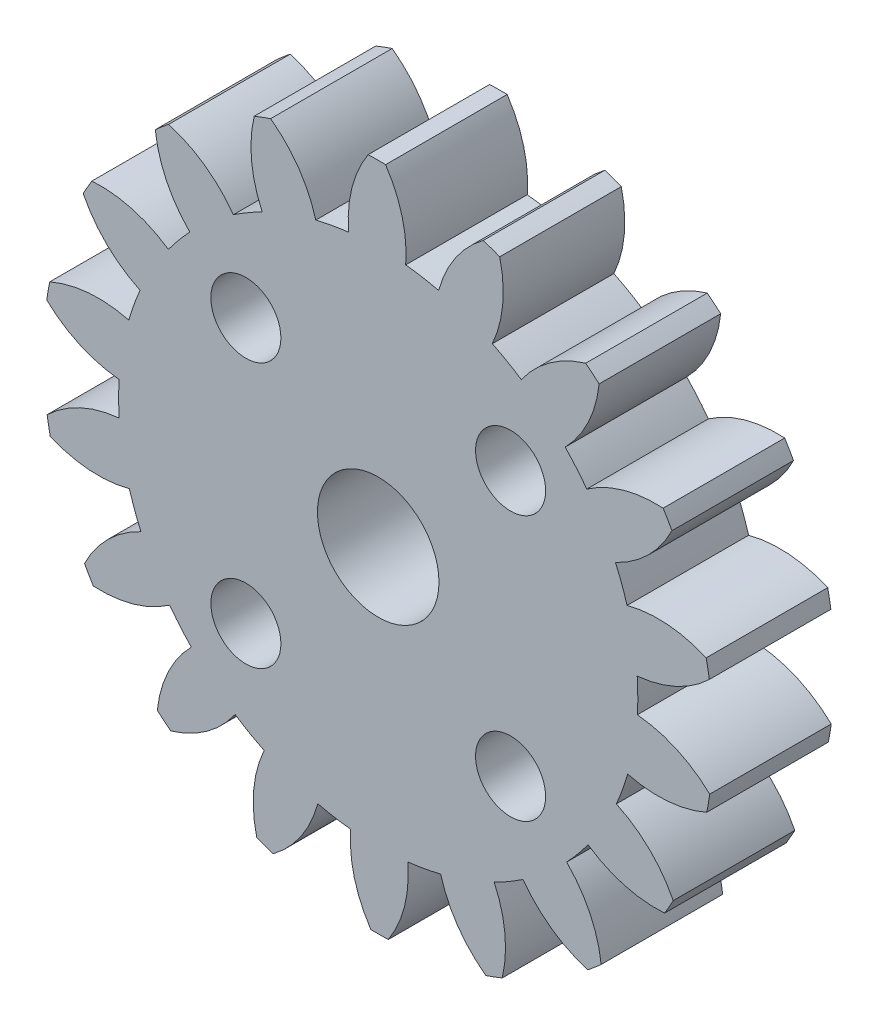
from build123d import *

# Parameters (mm, degrees)
BOSS_EXTRU_1_DEPTH = 3.175
ESQUISSE2_R        = 3.175
ESQUISSE2_R_2      = 1.83
CUT_EXTRUDE1_DEPTH = 26.426049992


with BuildPart() as part:
    # Esquisse1 → Boss.-Extru.1 (new, symmetric)
    with BuildSketch(Plane.XY):
        with BuildLine():
            ThreePointArc((12.39632517, 5.499582215), (14.117106651, 6.707055833), (15.344833887, 8.413445964))
            ThreePointArc((15.344833887, 8.413445964), (15.119886604, 8.811301214), (14.884626197, 9.203146363))
            ThreePointArc((14.884626197, 9.203146363), (12.79475517, 8.97616501), (10.895903967, 8.074252844))
            ThreePointArc((10.895903967, 8.074252844), (10.353325809, 8.759162457), (9.767767389, 9.407709736))
            ThreePointArc((9.767767389, 9.407709736), (10.97179275, 11.130905713), (11.541859176, 13.154295373))
            ThreePointArc((11.541859176, 13.154295373), (11.194403365, 13.451220514), (10.839311962, 13.73897071))
            ThreePointArc((10.839311962, 13.73897071), (8.953107774, 12.81090002), (7.47724344, 11.313934452))
            ThreePointArc((7.47724344, 11.313934452), (6.733133864, 11.771966302), (5.961072705, 12.18112862))
            ThreePointArc((5.961072705, 12.18112862), (6.503118716, 14.21220409), (6.346765909, 16.308542623))
            ThreePointArc((6.346765909, 16.308542623), (5.918709868, 16.4687241), (5.486616734, 16.617672425))
            ThreePointArc((5.486616734, 16.617672425), (4.031583448, 15.100451419), (3.156717001, 13.18898859))
            ThreePointArc((3.156717001, 13.18898859), (2.300826605, 13.364897275), (1.435384677, 13.485323618))
            ThreePointArc((1.435384677, 13.485323618), (1.25007259, 15.579300904), (0.386159005, 17.495738945))
            ThreePointArc((0.386159005, 17.495738945), (-0.07086739, 17.499856508), (-0.527845446, 17.492037594))
            ThreePointArc((-0.527845446, 17.492037594), (-1.376209343, 15.568665517), (-1.544556096, 13.473256055))
            ThreePointArc((-1.544556096, 13.473256055), (-2.408994299, 13.345824393), (-3.263431928, 13.162989565))
            ThreePointArc((-3.263431928, 13.162989565), (-4.15375074, 15.067304103), (-5.621024374, 16.57269094))
            ThreePointArc((-5.621024374, 16.57269094), (-6.051896994, 16.420247951), (-6.478641676, 16.256604874))
            ThreePointArc((-6.478641676, 16.256604874), (-6.618010975, 14.159068786), (-6.059532932, 12.132449995))
            ThreePointArc((-6.059532932, 12.132449995), (-6.828254938, 11.717048125), (-7.568630479, 11.253004706))
            ThreePointArc((-7.568630479, 11.253004706), (-9.056570428, 12.737968057), (-10.950229256, 13.650731821))
            ThreePointArc((-10.950229256, 13.650731821), (-11.302978505, 13.360115154), (-11.648018105, 13.060385685))
            ThreePointArc((-11.648018105, 13.060385685), (-11.061582813, 11.041679393), (-9.843640668, 9.328291411))
            ThreePointArc((-9.843640668, 9.328291411), (-10.423927257, 8.675022928), (-10.960940493, 7.985741403))
            ThreePointArc((-10.960940493, 7.985741403), (-12.867034061, 8.872245071), (-14.958674882, 9.082292981))
            ThreePointArc((-14.958674882, 9.082292981), (-15.190753994, 8.688555294), (-15.412471643, 8.288891231))
            ThreePointArc((-15.412471643, 8.288891231), (-14.170964512, 6.592500507), (-12.440460063, 5.399003211))
            ThreePointArc((-12.440460063, 5.399003211), (-12.762320108, 4.586661936), (-13.031199317, 3.75527983))
            ThreePointArc((-13.031199317, 3.75527983), (-15.12554349, 3.93639839), (-17.16288355, 3.418395567))
            ThreePointArc((-17.16288355, 3.418395567), (-17.246300359, 2.969027437), (-17.317953638, 2.517634164))
            ThreePointArc((-17.317953638, 2.517634164), (-15.57111875, 1.348168766), (-13.536776372, 0.818515543))
            ThreePointArc((-13.536776372, 0.818515543), (-13.561388802, -0.054918177), (-13.529703184, -0.928123913))
            ThreePointArc((-13.529703184, -0.928123913), (-15.559689144, -1.474236033), (-17.296995165, -2.657810803))
            ThreePointArc((-17.296995165, -2.657810803), (-17.221688373, -3.108608947), (-17.134634839, -3.55728674))
            ThreePointArc((-17.134634839, -3.55728674), (-15.093166261, -4.058772026), (-13.00035767, -3.860697179))
            ThreePointArc((-13.00035767, -3.860697179), (-12.724753862, -4.689874348), (-12.39632517, -5.499582215))
            ThreePointArc((-12.39632517, -5.499582215), (-14.117106651, -6.707055833), (-15.344833887, -8.413445964))
            ThreePointArc((-15.344833887, -8.413445964), (-15.119886604, -8.811301214), (-14.884626197, -9.203146363))
            ThreePointArc((-14.884626197, -9.203146363), (-12.79475517, -8.97616501), (-10.895903967, -8.074252844))
            ThreePointArc((-10.895903967, -8.074252844), (-10.353325809, -8.759162457), (-9.767767389, -9.407709736))
            ThreePointArc((-9.767767389, -9.407709736), (-10.97179275, -11.130905713), (-11.541859176, -13.154295373))
            ThreePointArc((-11.541859176, -13.154295373), (-11.194403365, -13.451220514), (-10.839311962, -13.73897071))
            ThreePointArc((-10.839311962, -13.73897071), (-8.953107774, -12.81090002), (-7.47724344, -11.313934452))
            ThreePointArc((-7.47724344, -11.313934452), (-6.733133864, -11.771966302), (-5.961072705, -12.18112862))
            ThreePointArc((-5.961072705, -12.18112862), (-6.503118716, -14.21220409), (-6.346765909, -16.308542623))
            ThreePointArc((-6.346765909, -16.308542623), (-5.918709868, -16.4687241), (-5.486616734, -16.617672425))
            ThreePointArc((-5.486616734, -16.617672425), (-4.031583448, -15.100451419), (-3.156717001, -13.18898859))
            ThreePointArc((-3.156717001, -13.18898859), (-2.300826605, -13.364897275), (-1.435384677, -13.485323618))
            ThreePointArc((-1.435384677, -13.485323618), (-1.25007259, -15.579300904), (-0.386159005, -17.495738945))
            ThreePointArc((-0.386159005, -17.495738945), (0.07086739, -17.499856508), (0.527845446, -17.492037594))
            ThreePointArc((0.527845446, -17.492037594), (1.376209343, -15.568665517), (1.544556096, -13.473256055))
            ThreePointArc((1.544556096, -13.473256055), (2.408994299, -13.345824393), (3.263431928, -13.162989565))
            ThreePointArc((3.263431928, -13.162989565), (4.15375074, -15.067304103), (5.621024374, -16.57269094))
            ThreePointArc((5.621024374, -16.57269094), (6.051896994, -16.420247951), (6.478641676, -16.256604874))
            ThreePointArc((6.478641676, -16.256604874), (6.618010975, -14.159068786), (6.059532932, -12.132449995))
            ThreePointArc((6.059532932, -12.132449995), (6.828254938, -11.717048125), (7.568630479, -11.253004706))
            ThreePointArc((7.568630479, -11.253004706), (9.056570428, -12.737968057), (10.950229256, -13.650731821))
            ThreePointArc((10.950229256, -13.650731821), (11.302978505, -13.360115154), (11.648018105, -13.060385685))
            ThreePointArc((11.648018105, -13.060385685), (11.061582813, -11.041679393), (9.843640668, -9.328291411))
            ThreePointArc((9.843640668, -9.328291411), (10.423927257, -8.675022928), (10.960940493, -7.985741403))
            ThreePointArc((10.960940493, -7.985741403), (12.867034061, -8.872245071), (14.958674882, -9.082292981))
            ThreePointArc((14.958674882, -9.082292981), (15.190753994, -8.688555294), (15.412471643, -8.288891231))
            ThreePointArc((15.412471643, -8.288891231), (14.170964512, -6.592500507), (12.440460063, -5.399003211))
            ThreePointArc((12.440460063, -5.399003211), (12.762320108, -4.586661936), (13.031199317, -3.75527983))
            ThreePointArc((13.031199317, -3.75527983), (15.12554349, -3.93639839), (17.16288355, -3.418395567))
            ThreePointArc((17.16288355, -3.418395567), (17.246300359, -2.969027437), (17.317953638, -2.517634164))
            ThreePointArc((17.317953638, -2.517634164), (15.57111875, -1.348168766), (13.536776372, -0.818515543))
            ThreePointArc((13.536776372, -0.818515543), (13.561388802, 0.054918177), (13.529703184, 0.928123913))
            ThreePointArc((13.529703184, 0.928123913), (15.559689144, 1.474236033), (17.296995165, 2.657810803))
            ThreePointArc((17.296995165, 2.657810803), (17.221688373, 3.108608947), (17.134634839, 3.55728674))
            ThreePointArc((17.134634839, 3.55728674), (15.093166261, 4.058772026), (13.00035767, 3.860697179))
            ThreePointArc((13.00035767, 3.860697179), (12.724753862, 4.689874348), (12.39632517, 5.499582215))
        make_face()
    extrude(amount=BOSS_EXTRU_1_DEPTH, both=True)

    # Esquisse2 → Cut-Extrude1 (cut, through all)
    with BuildSketch(Plane.XY.offset(3.175)):
        Circle(ESQUISSE2_R)
        with Locations((6.914797213, 6.914797213)):
            Circle(ESQUISSE2_R_2)
        with Locations((6.914797213, -6.914797213)):
            Circle(ESQUISSE2_R_2)
        with Locations((-6.914797213, -6.914797213)):
            Circle(ESQUISSE2_R_2)
        with Locations((-6.914797213, 6.914797213)):
            Circle(ESQUISSE2_R_2)
    extrude(amount=-CUT_EXTRUDE1_DEPTH, mode=Mode.SUBTRACT)


solid = part.part
